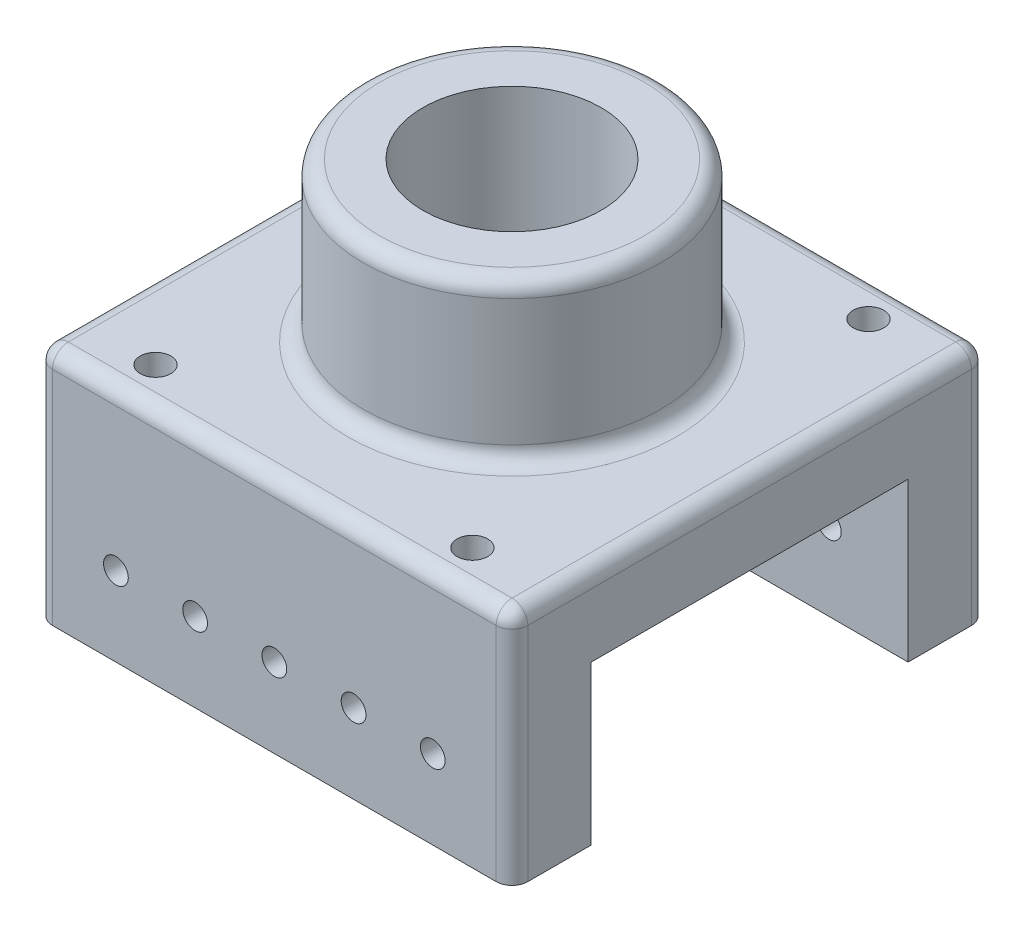
from build123d import *

# Parameters (mm, degrees)
SKETCH2_W                       = 76.2
SKETCH2_H                       = 76.2
SKETCH2_R                       = 14.2875
BOSS_EXTRUDE1_DEPTH             = 12.7
SKETCH3_R                       = 23.8125
SKETCH3_R_2                     = 14.2875
BOSS_EXTRUDE2_DEPTH             = 25.4
SKETCH4_W                       = 76.2
SKETCH4_H                       = 12.7
BOSS_EXTRUDE3_DEPTH             = 25.4
F_10_0_1935_DIAMETER_HOLE1_D    = 4.9149
FILLET1_R                       = 2.54
FILLET2_R                       = 2.54
F_5_32_0_15625_DIAMETER_HOLE1_D = 3.96875


with BuildPart() as part:
    # Sketch2 → Boss-Extrude1 (new body)
    with BuildSketch(Plane(origin=(0, 0, 0), x_dir=(1, 0, 0), z_dir=(0, 1, 0))):
        Rectangle(SKETCH2_W, SKETCH2_H)
        with Locations(Location((0, 0, 0), (0, 0, 270))):
            Circle(SKETCH2_R, mode=Mode.SUBTRACT)
    extrude(amount=BOSS_EXTRUDE1_DEPTH)

    # Sketch3 → Boss-Extrude2 (add)
    with BuildSketch(Plane(origin=(0, 12.7, 0), x_dir=(1, 0, 0), z_dir=(0, 1, 0))):
        with Locations(Location((0, 0, 0), (0, 0, 270))):
            Circle(SKETCH3_R)
        with Locations(Location((0, 0, 0), (0, 0, 270))):
            Circle(SKETCH3_R_2, mode=Mode.SUBTRACT)
    extrude(amount=BOSS_EXTRUDE2_DEPTH)

    # Sketch4 → Boss-Extrude3 (add)
    with BuildSketch(Plane.XZ):
        with Locations((0, -31.75)):
            Rectangle(SKETCH4_W, SKETCH4_H)
        with Locations((0, 31.75)):
            Rectangle(SKETCH4_W, SKETCH4_H)
    extrude(amount=BOSS_EXTRUDE3_DEPTH)

    # #10 (0.1935) Diameter Hole1 (through all)
    with Locations(Plane(origin=(0, -25.4, 0), x_dir=(-1, 0, 0), z_dir=(0, -1, 0))):
        with Locations((-25.4, 31.75), (25.4, 31.75), (25.4, -31.75), (-25.4, -31.75)):
            Hole(F_10_0_1935_DIAMETER_HOLE1_D / 2)

    # Fillet1
    fillet1_edges = [part.edges().sort_by_distance(p)[0] for p in [
        (0, 12.7, -23.8125),
        (0, 38.1, -23.8125),
        (38.1, -6.35, 38.1),
        (-38.1, -6.35, 38.1),
        (-38.1, -6.35, -38.1),
        (38.1, -6.35, -38.1),
    ]]
    fillet(fillet1_edges, radius=FILLET1_R)

    # Fillet2
    fillet2_edges = [part.edges().sort_by_distance(p)[0] for p in [
        (38.1, 12.7, 0),
        (0, 12.7, 38.1),
        (0, 12.7, -38.1),
        (-38.1, 12.7, 0),
        (37.356051224, 12.7, -37.356051224),
        (-37.356051224, 12.7, -37.356051224),
        (-37.356051224, 12.7, 37.356051224),
        (37.356051224, 12.7, 37.356051224),
    ]]
    fillet(fillet2_edges, radius=FILLET2_R)

    # 5/32 (0.15625) Diameter Hole1 (through all)
    with Locations(Plane(origin=(0, 0, -38.1), x_dir=(-1, 0, 0), z_dir=(0, 0, -1))):
        with Locations((0, -12.7), (12.7, -12.7), (25.4, -12.7), (-12.7, -12.7), (-25.4, -12.7)):
            Hole(F_5_32_0_15625_DIAMETER_HOLE1_D / 2)


solid = part.part
